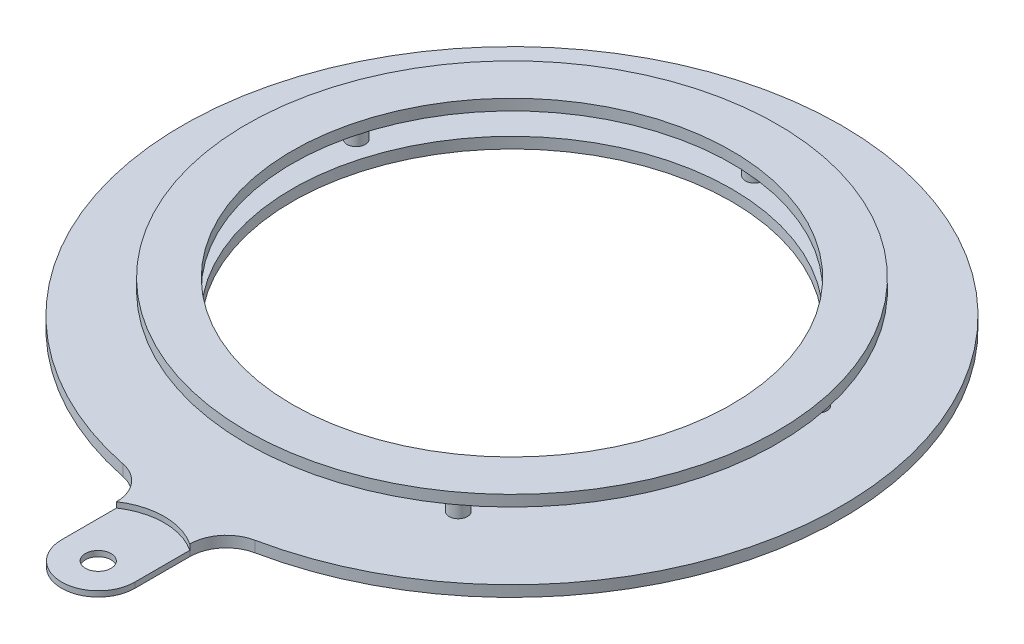
from build123d import *

# Parameters (mm, degrees)
SKETCH_1_R               = 72.5
SKETCH_1_R_2             = 60
EXTRUDE_1_DEPTH          = 3
SKETCH_2_R               = 2.5
EXTRUDE_2_DEPTH          = 6
PATTERN_CIRCULAR_1_COUNT = 5
EXTRUDE_START            = 3
SKETCH_3_R               = 60
EXTRUDE_3_DEPTH          = 3
SKETCH_4_R               = 3.5
CUT_EXTRUDE_1_DEPTH      = 10
SKETCH_5_R               = 18.027756377
CUT_EXTRUDE_2_DEPTH      = 1.5


with BuildPart() as part:
    # 草图1 → 凸台-拉伸1 (new body)
    with BuildSketch(Plane(origin=(0, 0, 0), x_dir=(1, 0, 0), z_dir=(0, 1, 0))):
        with Locations(Location((0, 0, 0), (0, 0, 270))):
            Circle(SKETCH_1_R)
        with Locations(Location((0, 0, 0), (0, 0, 270))):
            Circle(SKETCH_1_R_2, mode=Mode.SUBTRACT)
    extrude(amount=EXTRUDE_1_DEPTH)

    # 草图2 → 凸台-拉伸2 (add)
    with BuildSketch(Plane(origin=(0, 0, 0), x_dir=(1, 0, 0), z_dir=(0, 1, 0))):
        with Locations(Location((0, 66.25, 0), (0, 0, 270))):
            Circle(SKETCH_2_R)
    extrude_2 = extrude(amount=-EXTRUDE_2_DEPTH)

    # 阵列(圆周)1: 凸台-拉伸2 ×5 about axis
    pattern_circular_1_axis = Axis((0, 0, 0), (0, 1, 0))
    for i in range(1, PATTERN_CIRCULAR_1_COUNT):
        add(extrude_2.rotate(pattern_circular_1_axis, i * 360 / PATTERN_CIRCULAR_1_COUNT))

    # 草图3 → 凸台-拉伸3 (add)
    with BuildSketch(Plane.XZ.offset(6).offset(EXTRUDE_START)):
        with BuildLine():
            Line((10, 112.979589711), (10, 97.979589711))
            ThreePointArc((10, 97.979589711), (12.254033308, 91.655034391), (18, 88.18163074))
            ThreePointArc((18, 88.18163074), (0, -90), (-18, 88.18163074))
            ThreePointArc((-18, 88.18163074), (-12.254033308, 91.655034391), (-10, 97.979589711))
            Line((-10, 97.979589711), (-10, 112.979589711))
            ThreePointArc((-10, 112.979589711), (0, 122.979589711), (10, 112.979589711))
        make_face()
        with Locations(Location((0, 0, 0), (0, 0, 90))):
            Circle(SKETCH_3_R, mode=Mode.SUBTRACT)
    extrude(amount=-EXTRUDE_3_DEPTH)

    # 草图4 → 切除-拉伸1 (cut)
    with BuildSketch(Plane(origin=(0, 0, 0), x_dir=(1, 0, 0), z_dir=(0, 1, 0))):
        with Locations(Location((0, -112.979589711, 0), (0, 0, 90))):
            Circle(SKETCH_4_R)
    extrude(amount=-CUT_EXTRUDE_1_DEPTH, mode=Mode.SUBTRACT)

    # 草图5 → 切除-拉伸2 (cut)
    with BuildSketch(Plane(origin=(0, -6, 0), x_dir=(1, 0, 0), z_dir=(0, 1, 0))):
        with Locations((0, -112.979589711)):
            Circle(SKETCH_5_R)
    extrude(amount=-CUT_EXTRUDE_2_DEPTH, mode=Mode.SUBTRACT)


solid = part.part
